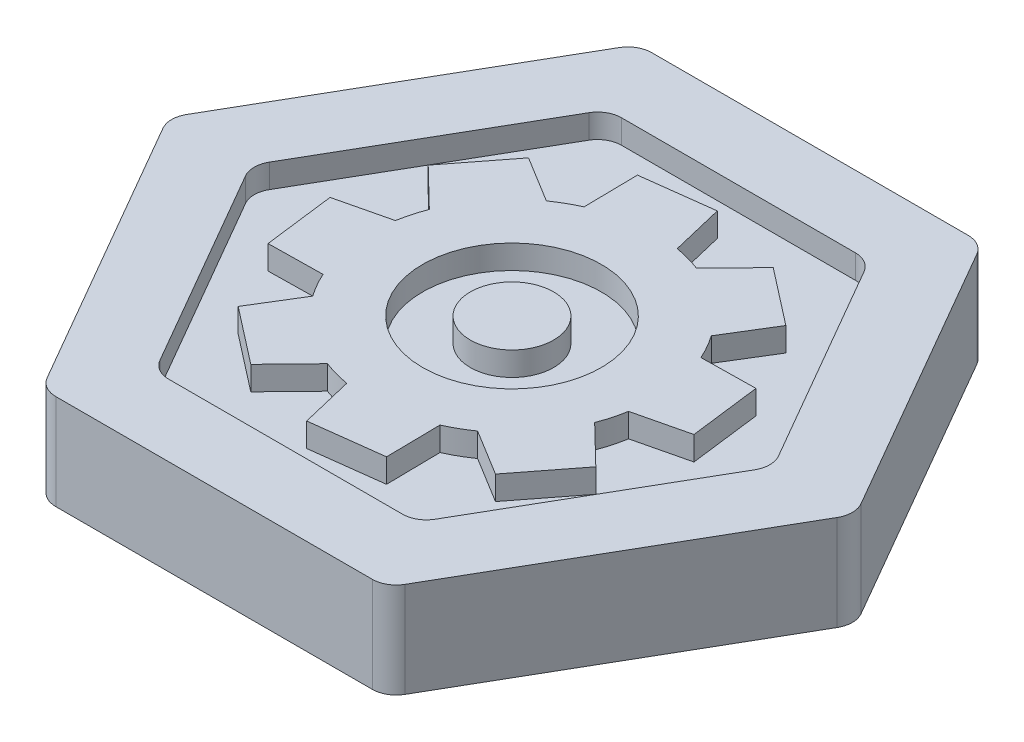
from build123d import *

# Parameters (mm, degrees)
EXTRUDE_1_DEPTH     = 4
CUT_EXTRUDE_1_DEPTH = 1
SKETCH_3_R          = 3.75
SKETCH_3_R_2        = 1.75
EXTRUDE_2_DEPTH     = 1
FILLET_1_R          = 1


with BuildPart() as part:
    # 草图1 → 凸台-拉伸1 (new body)
    with BuildSketch(Plane(origin=(0, 0, 0), x_dir=(1, 0, 0), z_dir=(0, 1, 0))):
        Polygon((14.43375673, 0), (7.216878365, 12.5), (-7.216878365, 12.5), (-14.43375673, 0), (-7.216878365, -12.5), (7.216878365, -12.5), align=None)
    extrude(amount=EXTRUDE_1_DEPTH)

    # 草图2 → 切除-拉伸1 (cut)
    with BuildSketch(Plane(origin=(0, 4, 0), x_dir=(1, 0, 0), z_dir=(0, 1, 0))):
        Polygon((5.484827557, -9.5), (10.969655115, 0), (5.484827557, 9.5), (-5.484827557, 9.5), (-10.969655115, 0), (-5.484827557, -9.5), align=None)
    extrude(amount=-CUT_EXTRUDE_1_DEPTH, mode=Mode.SUBTRACT)

    # 草图3 → 凸台-拉伸2 (add)
    # profile 1 of 2: a face of its own
    with BuildSketch(Plane(origin=(0, 3, 0), x_dir=(1, 0, 0), z_dir=(0, 1, 0))):
        with BuildLine():
            Line((8.124640736, -0.490115197), (7.750329512, 2.486441724))
            Line((7.750329512, 2.486441724), (5.47592438, 2.452397232))
            ThreePointArc((5.47592438, 2.452397232), (5.213474627, 2.969794996), (4.902281736, 3.4594268))
            Line((4.902281736, 3.4594268), (6.091552339, 5.39842478))
            Line((6.091552339, 5.39842478), (3.72213075, 7.238490359))
            Line((3.72213075, 7.238490359), (2.137956549, 5.606169975))
            ThreePointArc((2.137956549, 5.606169975), (1.586521082, 5.786445442), (1.02025251, 5.912620808))
            Line((1.02025251, 5.912620808), (0.490115197, 8.124640736))
            Line((0.490115197, 8.124640736), (-2.486441724, 7.750329512))
            Line((-2.486441724, 7.750329512), (-2.452397232, 5.47592438))
            ThreePointArc((-2.452397232, 5.47592438), (-2.969794996, 5.213474627), (-3.4594268, 4.902281736))
            Line((-3.4594268, 4.902281736), (-5.39842478, 6.091552339))
            Line((-5.39842478, 6.091552339), (-7.238490359, 3.72213075))
            Line((-7.238490359, 3.72213075), (-5.606169975, 2.137956549))
            ThreePointArc((-5.606169975, 2.137956549), (-5.786445442, 1.586521082), (-5.912620808, 1.02025251))
            Line((-5.912620808, 1.02025251), (-8.124640736, 0.490115197))
            Line((-8.124640736, 0.490115197), (-7.750329512, -2.486441724))
            Line((-7.750329512, -2.486441724), (-5.47592438, -2.452397232))
            ThreePointArc((-5.47592438, -2.452397232), (-5.213474627, -2.969794996), (-4.902281736, -3.4594268))
            Line((-4.902281736, -3.4594268), (-6.091552339, -5.39842478))
            Line((-6.091552339, -5.39842478), (-3.72213075, -7.238490359))
            Line((-3.72213075, -7.238490359), (-2.137956549, -5.606169975))
            ThreePointArc((-2.137956549, -5.606169975), (-1.586521082, -5.786445442), (-1.02025251, -5.912620808))
            Line((-1.02025251, -5.912620808), (-0.490115197, -8.124640736))
            Line((-0.490115197, -8.124640736), (2.486441724, -7.750329512))
            Line((2.486441724, -7.750329512), (2.452397232, -5.47592438))
            ThreePointArc((2.452397232, -5.47592438), (2.969794996, -5.213474627), (3.4594268, -4.902281736))
            Line((3.4594268, -4.902281736), (5.39842478, -6.091552339))
            Line((5.39842478, -6.091552339), (7.238490359, -3.72213075))
            Line((7.238490359, -3.72213075), (5.606169975, -2.137956549))
            ThreePointArc((5.606169975, -2.137956549), (5.786445442, -1.586521082), (5.912620808, -1.02025251))
            Line((5.912620808, -1.02025251), (8.124640736, -0.490115197))
        make_face()
        with Locations(Location((0, 0, 0), (0, 0, 270))):
            Circle(SKETCH_3_R, mode=Mode.SUBTRACT)
    # profile 2 of 2: a face of its own
    with BuildSketch(Plane(origin=(0, 3, 0), x_dir=(1, 0, 0), z_dir=(0, 1, 0))):
        with Locations(Location((0, 0, 0), (0, 0, 270))):
            Circle(SKETCH_3_R_2)
    extrude(amount=EXTRUDE_2_DEPTH)

    # 圆角1
    fillet_1_edges = [part.edges().sort_by_distance(p)[0] for p in [
        (7.216878365, 2, 12.5),
        (-7.216878365, 2, 12.5),
        (-14.43375673, 2, 0),
        (-7.216878365, 2, -12.5),
        (7.216878365, 2, -12.5),
        (14.43375673, 2, 0),
        (5.484827557, 3.5, 9.5),
        (-5.484827557, 3.5, 9.5),
        (-10.969655115, 3.5, 0),
        (-5.484827557, 3.5, -9.5),
        (5.484827557, 3.5, -9.5),
        (10.969655115, 3.5, 0),
    ]]
    fillet(fillet_1_edges, radius=FILLET_1_R)


solid = part.part
